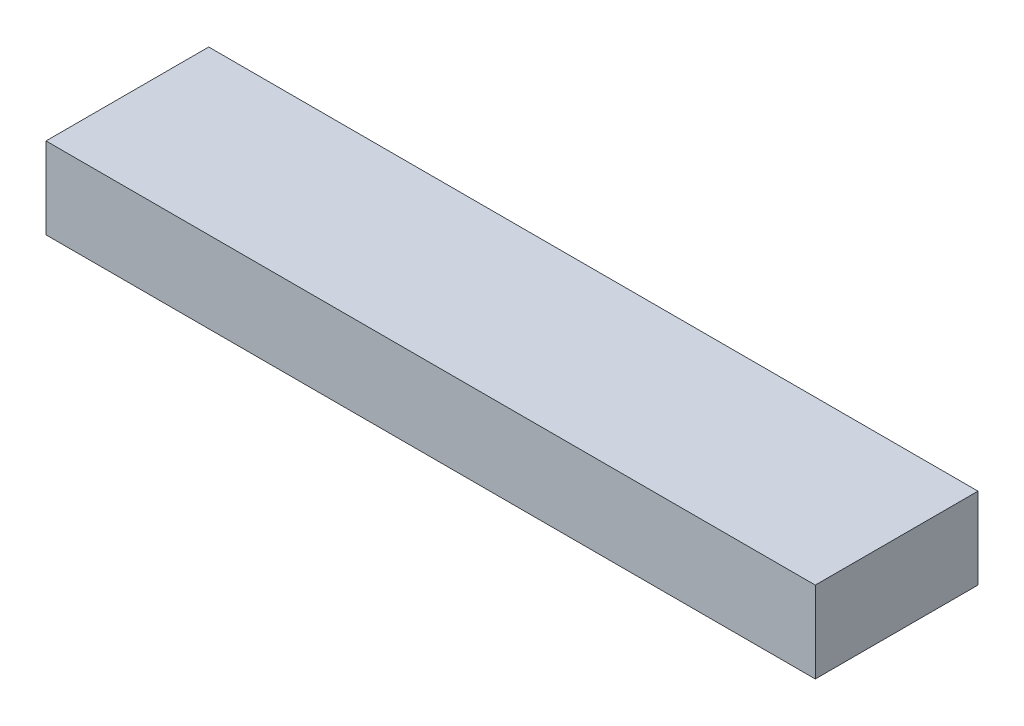
from build123d import *

# Parameters (mm, degrees)
SKETCH_1_W      = 47.28
SKETCH_1_H      = 10
EXTRUDE_1_DEPTH = 5


with BuildPart() as part:
    # 草图1 → 凸台-拉伸1 (new body)
    with BuildSketch(Plane(origin=(0, 0, 0), x_dir=(1, 0, 0), z_dir=(0, 1, 0))):
        with Locations((23.64, -5)):
            Rectangle(SKETCH_1_W, SKETCH_1_H)
    extrude(amount=EXTRUDE_1_DEPTH)


solid = part.part
